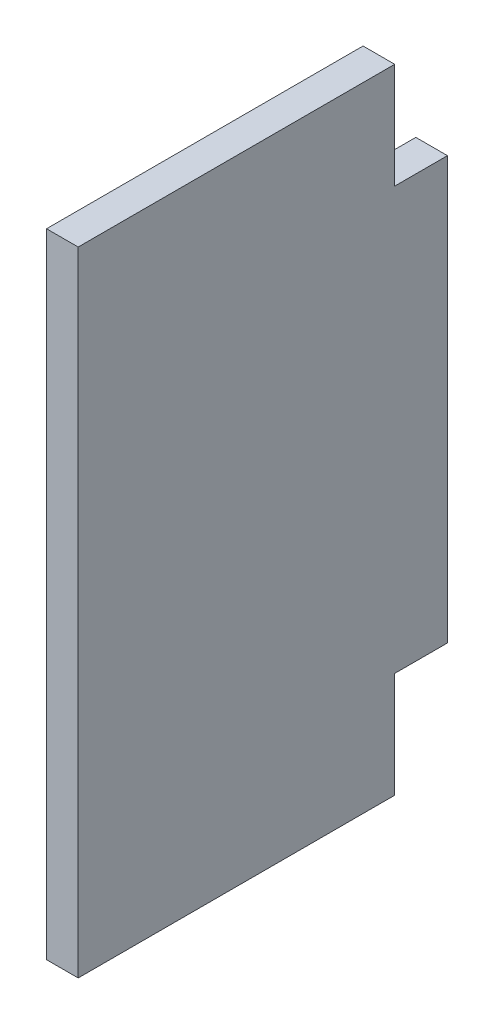
from build123d import *

# Parameters (mm, degrees)
ESTRUSIONE_ESTRUSIONE1_DEPTH      = 30
ESTRUSIONE_ESTRUSIONE1_DEPTH_BACK = 5
SCHIZZO1_W                        = 3
SCHIZZO1_H                        = 40
SCHIZZO2_W                        = 3
SCHIZZO2_H                        = 30
ESTRUSIONE_ESTRUSIONE2_DEPTH      = 10


with BuildPart() as part:
    # Schizzo1 → Estrusione-Estrusione1 (new, two sides: drawn at the far end of the back side and taken through both)
    with BuildSketch(Plane.XY.offset(-ESTRUSIONE_ESTRUSIONE1_DEPTH_BACK)):
        with Locations((88.042298103, 0)):
            Rectangle(SCHIZZO1_W, SCHIZZO1_H)
    extrude(amount=ESTRUSIONE_ESTRUSIONE1_DEPTH + ESTRUSIONE_ESTRUSIONE1_DEPTH_BACK)

    # Schizzo2 → Estrusione-Estrusione2 (add)
    with BuildSketch(Plane(origin=(0, 20, 0), x_dir=(1, 0, 0), z_dir=(0, 1, 0))):
        with Locations((88.042298103, -15)):
            Rectangle(SCHIZZO2_W, SCHIZZO2_H)
    estrusione_estrusione2 = extrude(amount=ESTRUSIONE_ESTRUSIONE2_DEPTH)

    # Specchia1: Estrusione-Estrusione2 across plane
    add(estrusione_estrusione2.mirror(Plane.ZX))


solid = part.part
